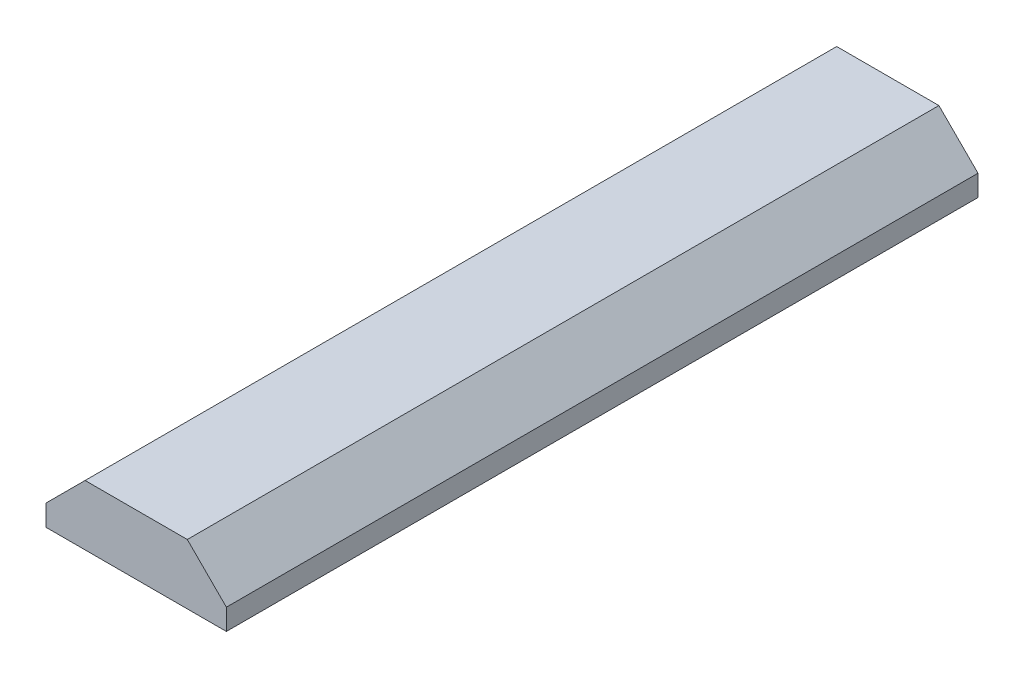
from build123d import *

# Parameters (mm, degrees)
AUFSATZ_LINEAR_AUSTRAGEN1_DEPTH = 50


with BuildPart() as part:
    # Skizze1 → Aufsatz-Linear austragen1 (new body)
    with BuildSketch(Plane.XY):
        Polygon((3.4, 1.808858787), (-3.4, 1.808858787), (-6, -0.791141213), (-6, -2.191141213), (6, -2.191141213), (6, -0.791141213), align=None)
    extrude(amount=AUFSATZ_LINEAR_AUSTRAGEN1_DEPTH)


solid = part.part
